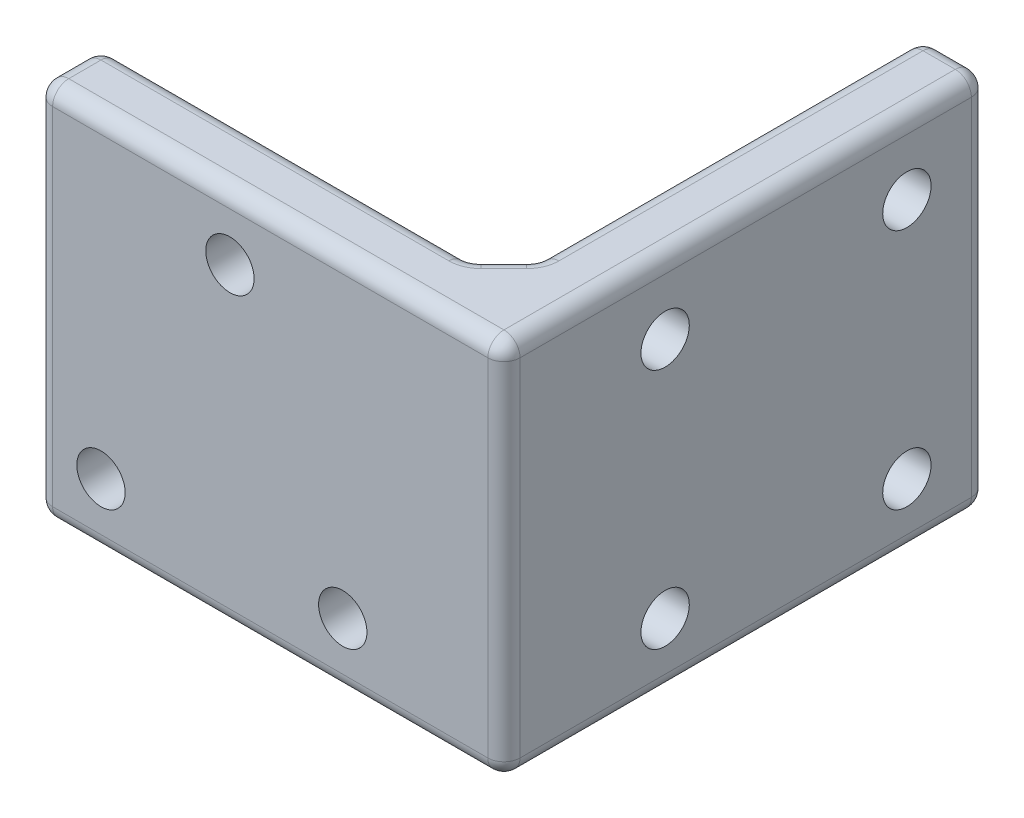
from build123d import *

# Parameters (mm, degrees)
SKETCH_1_W      = 25
SKETCH_1_H      = 23.5
SKETCH_1_R      = 1.5
EXTRUDE_1_DEPTH = 4
SKETCH_2_W      = 30
SKETCH_2_H      = 23.5
SKETCH_2_R      = 1.5
EXTRUDE_2_DEPTH = 4
CHAMFER_1_SIZE  = 2
FILLET_1_R      = 1


with BuildPart() as part:
    # 草图1 → 凸台-拉伸1 (new body)
    with BuildSketch(Plane.XY):
        with Locations((2.963131814, 3.167575845)):
            Rectangle(SKETCH_1_W, SKETCH_1_H)
        with Locations((2.463131814, 10.917575845)):
            Circle(SKETCH_1_R, mode=Mode.SUBTRACT)
        with Locations((-5.536868186, -4.582424155)):
            Circle(SKETCH_1_R, mode=Mode.SUBTRACT)
        with Locations((9.463131814, -4.582424155)):
            Circle(SKETCH_1_R, mode=Mode.SUBTRACT)
    extrude(amount=EXTRUDE_1_DEPTH)

    # 草图2 → 凸台-拉伸2 (add)
    with BuildSketch(Plane(origin=(15.463131814, 0, 0), x_dir=(0, 0, -1), z_dir=(1, 0, 0))):
        with Locations((11, 3.167575845)):
            Rectangle(SKETCH_2_W, SKETCH_2_H)
        with Locations(Location((6, 10.417575845, 0), (0, 0, 90))):
            Circle(SKETCH_2_R, mode=Mode.SUBTRACT)
        with Locations(Location((21, 10.417575845, 0), (0, 0, 90))):
            Circle(SKETCH_2_R, mode=Mode.SUBTRACT)
        with Locations(Location((6, -4.582424155, 0), (0, 0, 90))):
            Circle(SKETCH_2_R, mode=Mode.SUBTRACT)
        with Locations(Location((21, -4.582424155, 0), (0, 0, 90))):
            Circle(SKETCH_2_R, mode=Mode.SUBTRACT)
    extrude(amount=EXTRUDE_2_DEPTH)

    # 倒角1
    chamfer_1_edges = [part.edges().sort_by_distance(p)[0] for p in [
        (15.463131814, 3.167575845, 0),
    ]]
    chamfer(chamfer_1_edges, length=CHAMFER_1_SIZE)

    # 圆角1
    fillet_1_edges = [part.edges().sort_by_distance(p)[0] for p in [
        (4.963131814, 14.917575845, 4),
        (19.463131814, 3.167575845, 4),
        (19.463131814, -8.582424155, -11),
        (19.463131814, 3.167575845, -26),
        (19.463131814, 14.917575845, -11),
        (15.463131814, 3.167575845, -26),
        (17.463131814, -8.582424155, -26),
        (15.463131814, 14.917575845, -14),
        (17.463131814, 14.917575845, -26),
        (15.463131814, -8.582424155, -14),
        (15.463131814, 3.167575845, -2),
        (1.963131814, 14.917575845, 0),
        (-9.536868186, 3.167575845, 4),
        (13.463131814, 3.167575845, 0),
        (14.463131814, 14.917575845, -1),
        (14.463131814, -8.582424155, -1),
        (1.963131814, -8.582424155, 0),
        (-9.536868186, 3.167575845, 0),
        (-9.536868186, 14.917575845, 2),
        (-9.536868186, -8.582424155, 2),
        (4.963131814, -8.582424155, 4),
    ]]
    fillet(fillet_1_edges, radius=FILLET_1_R)


solid = part.part
